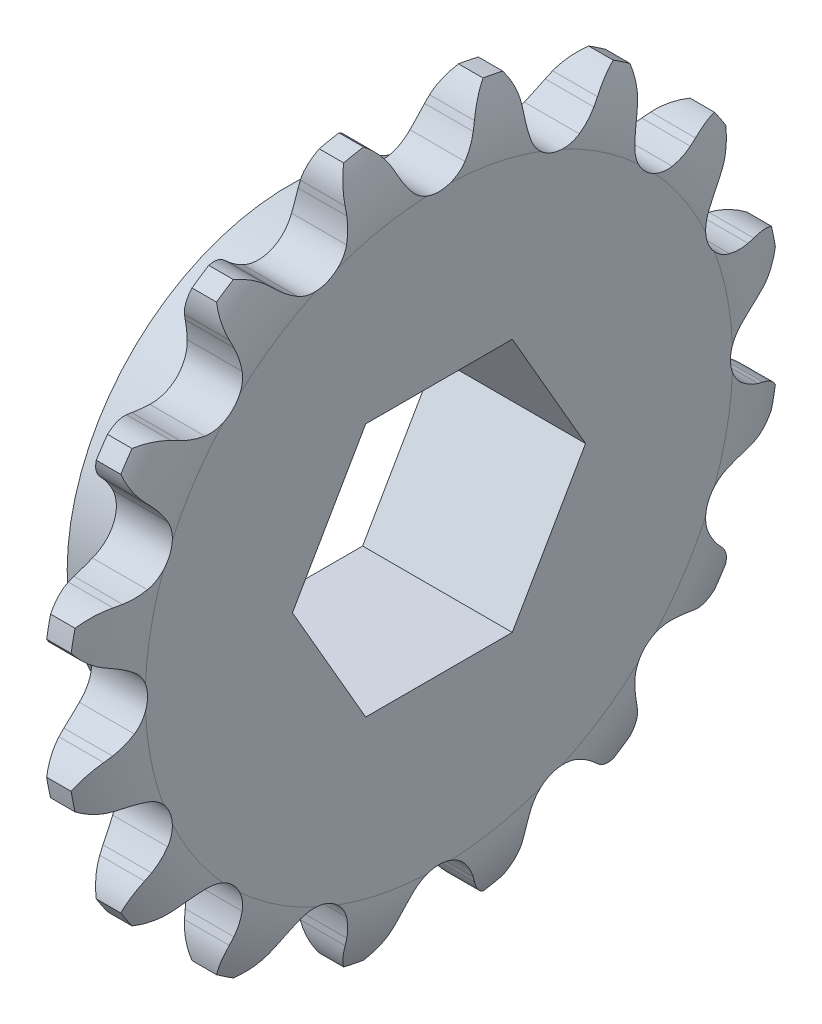
from build123d import *

# Parameters (mm, degrees)
TOOTHCUT_DEPTH     = 26.422180322
TEETHCUTS_COUNT    = 16
TEETHCUTS_ANGLE    = 337.5
HUBNEAONESKE_R     = 11.1125
HUBNEARONE_DEPTH   = 7.4867008
BORSKE_R           = 6.35
BORE_DEPTH         = 10.2870508
CUT_EXTRUDE1_DEPTH = 27.951739208
CUT_EXTRUDE2_START = -2.80035
SKETCH2_R          = 11.1125
CUT_EXTRUDE2_DEPTH = 2.80035


with BuildPart() as part:
    # BasProSke → Base-Revolve (revolve)
    with BuildSketch(Plane(origin=(0, 0, 0), x_dir=(1, 0, 0), z_dir=(0, 1, 0)), mode=Mode.PRIVATE) as base_revolve_sk:
        with BuildLine():
            Line((0, 0), (0, 14.691802906))
            ThreePointArc((0, 14.691802906), (0.199787117, 16.327393301), (0.7874, 17.866802906))
            Line((0.7874, 17.866802906), (2.01295, 17.866802906))
            ThreePointArc((2.01295, 17.866802906), (2.600562883, 16.327393301), (2.80035, 14.691802906))
            Line((2.80035, 14.691802906), (2.80035, 0))
            Line((2.80035, 0), (0, 0))
        make_face()
    revolve(base_revolve_sk.sketch.rotate(Axis((-10, 0, 0), (1, 0, 0)), 180), axis=Axis((-10, 0, 0), (1, 0, 0)))

    # TooCutSke → ToothCut (cut, through all)
    with BuildSketch(Plane(origin=(0, 0, 0), x_dir=(0, 0, -1), z_dir=(1, 0, 0))):
        with BuildLine():
            Line((1.895951627, 16.145861936), (2.051408679, 16.490963794))
            ThreePointArc((2.051408679, 16.490963794), (3.056004648, 17.659429898), (4.533974194, 18.095471314))
            ThreePointArc((4.533974194, 18.095471314), (0, 18.654838624), (-4.533974194, 18.095471314))
            ThreePointArc((-4.533974194, 18.095471314), (-3.056004648, 17.659429898), (-2.051408679, 16.490963794))
            Line((-2.051408679, 16.490963794), (-1.895951627, 16.145861936))
            ThreePointArc((-1.895951627, 16.145861936), (-1.639424454, 15.660854796), (-1.323740827, 15.212098776))
            ThreePointArc((-1.323740827, 15.212098776), (0, 14.577158112), (1.323740827, 15.212098776))
            ThreePointArc((1.323740827, 15.212098776), (1.639424454, 15.660854796), (1.895951627, 16.145861936))
        make_face()
    toothcut = extrude(amount=TOOTHCUT_DEPTH, mode=Mode.SUBTRACT)

    # TeethCuts: ToothCut ×16 about axis
    teethcuts_axis = Axis((-10, 0, 0), (1, 0, 0))
    for i in range(1, TEETHCUTS_COUNT):
        add(toothcut.rotate(teethcuts_axis, i * TEETHCUTS_ANGLE / (TEETHCUTS_COUNT - 1)), mode=Mode.SUBTRACT)

    # HubNeaOneSke → HubNearOne (add)
    with BuildSketch(Plane.ZY):
        with Locations(Location((0, 0, 0), (0, 0, 180))):
            Circle(HUBNEAONESKE_R)
    extrude(amount=HUBNEARONE_DEPTH)

    # BorSke → Bore (cut, symmetric)
    with BuildSketch(Plane(origin=(0, 0, 0), x_dir=(0, 0, -1), z_dir=(1, 0, 0))):
        with Locations(Location((0, 0, 0), (0, 0, 180))):
            Circle(BORSKE_R)
    extrude(amount=BORE_DEPTH, both=True, mode=Mode.SUBTRACT)

    # Sketch1 → Cut-Extrude1 (cut, through all)
    with BuildSketch(Plane(origin=(2.80035, 0, 0), x_dir=(0, 0, -1), z_dir=(1, 0, 0))):
        Polygon((7.332348419, 0), (3.666174209, 6.35), (-3.666174209, 6.35), (-7.332348419, 0), (-3.666174209, -6.35), (3.666174209, -6.35), align=None)
    extrude(amount=-CUT_EXTRUDE1_DEPTH, mode=Mode.SUBTRACT)

    # Sketch2 → Cut-Extrude2 (cut)
    with BuildSketch(Plane.ZY.offset(7.4867008).offset(CUT_EXTRUDE2_START)):
        with Locations(Location((0, 0, 0), (0, 0, 180))):
            Circle(SKETCH2_R)
    extrude(amount=CUT_EXTRUDE2_DEPTH, mode=Mode.SUBTRACT)


solid = part.part
